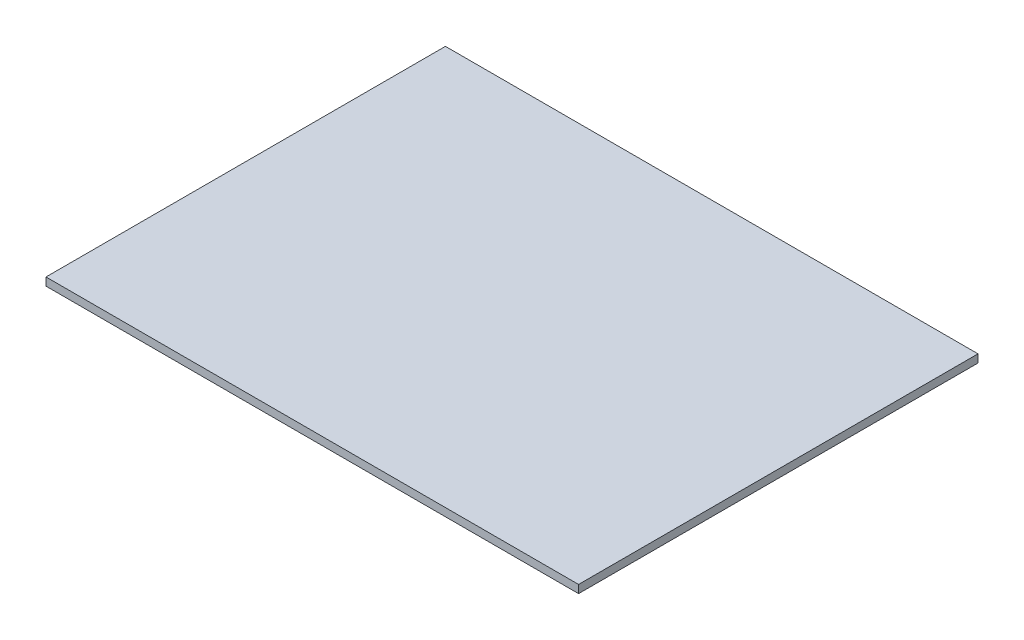
from build123d import *

# Parameters (mm, degrees)
ESQUISSE2_W        = 200
ESQUISSE2_H        = 150
BOSS_EXTRU_1_DEPTH = 3


with BuildPart() as part:
    # Esquisse2 → Boss.-Extru.1 (new body)
    with BuildSketch(Plane(origin=(0, 0, 0), x_dir=(1, 0, 0), z_dir=(0, 1, 0))):
        with Locations((100, 75)):
            Rectangle(ESQUISSE2_W, ESQUISSE2_H)
    extrude(amount=BOSS_EXTRU_1_DEPTH)


solid = part.part
